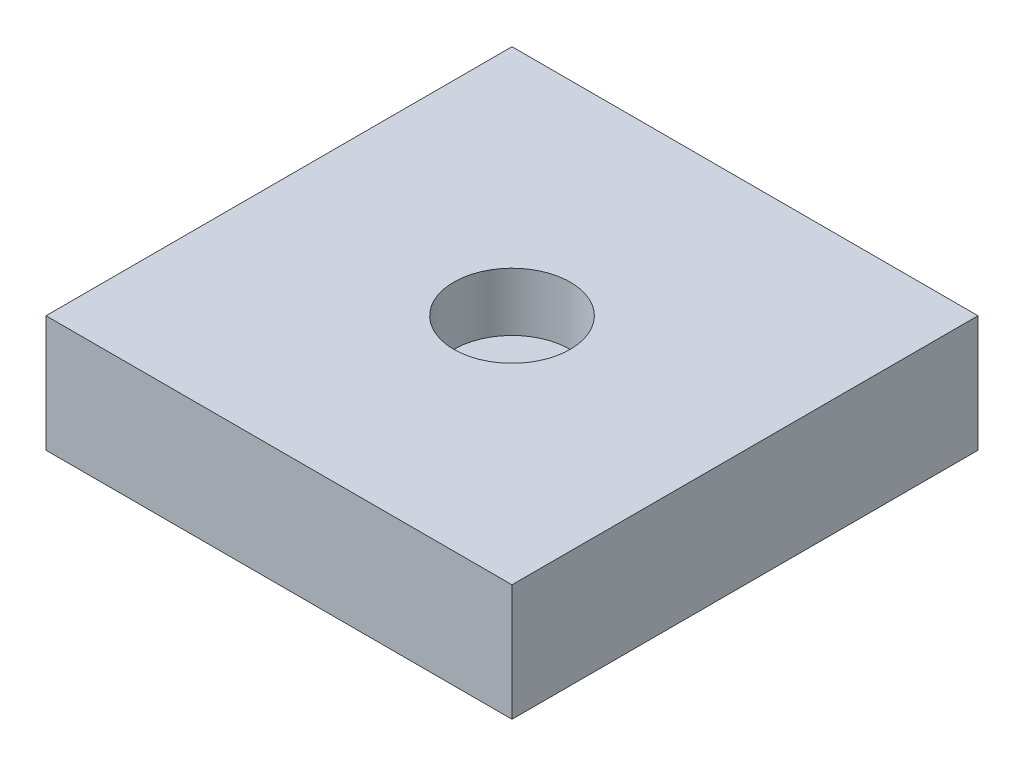
from build123d import *

# Parameters (mm, degrees)
SKETCH1_W           = 50.8
SKETCH1_H           = 50.8
BOSS_EXTRUDE1_DEPTH = 12.7
SKETCH2_R           = 6.35
CUT_EXTRUDE1_DEPTH  = 6.35


with BuildPart() as part:
    # Sketch1 → Boss-Extrude1 (new body)
    with BuildSketch(Plane(origin=(0, 0, 0), x_dir=(1, 0, 0), z_dir=(0, 1, 0))):
        Rectangle(SKETCH1_W, SKETCH1_H)
    extrude(amount=BOSS_EXTRUDE1_DEPTH)

    # Sketch2 → Cut-Extrude1 (cut)
    with BuildSketch(Plane(origin=(0, 12.7, 0), x_dir=(1, 0, 0), z_dir=(0, 1, 0))):
        with Locations(Location((0, 0, 0), (0, 0, 270))):
            Circle(SKETCH2_R)
    extrude(amount=-CUT_EXTRUDE1_DEPTH, mode=Mode.SUBTRACT)


solid = part.part
